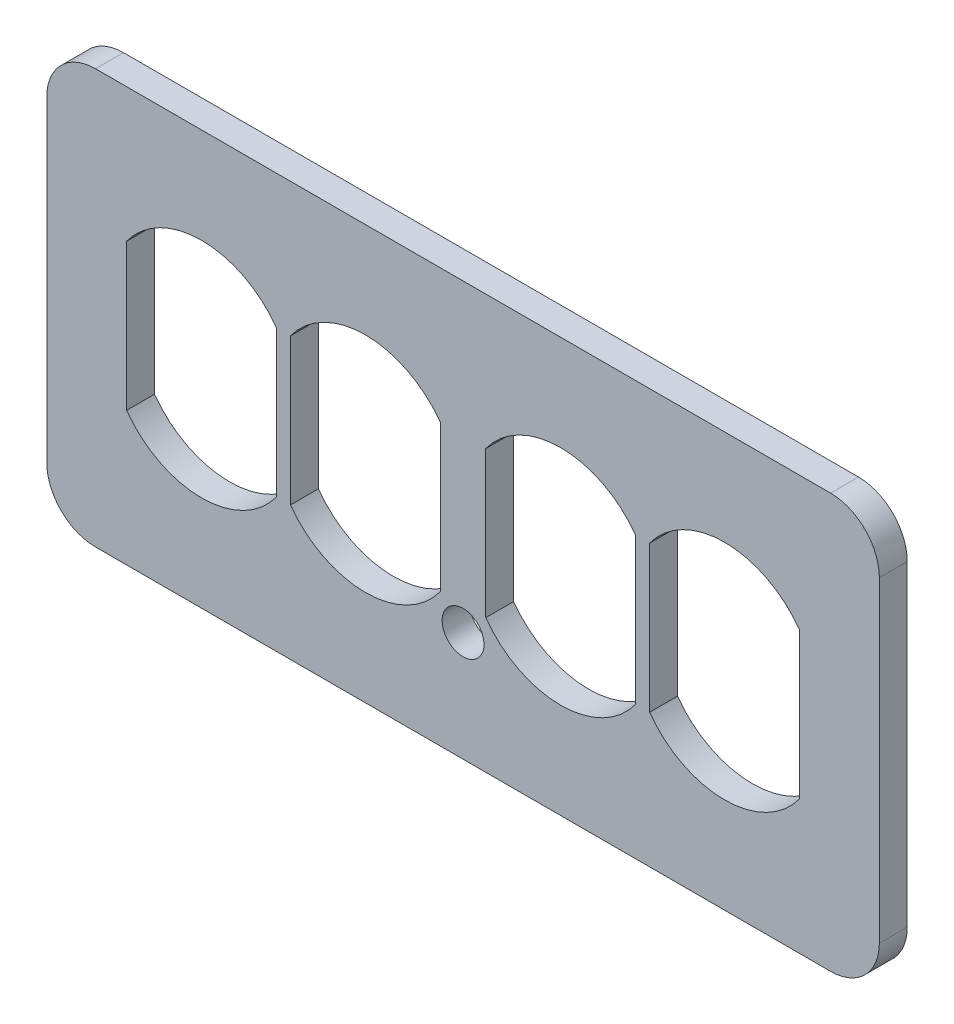
from build123d import *

# Parameters (mm, degrees)
SKETCH_1_W      = 119.4
SKETCH_1_H      = 59.4
SKETCH_1_R      = 3
EXTRUDE_1_DEPTH = 4
FILLET_1_R      = 7


with BuildPart() as part:
    # Эскиз1 → Бобышка-Вытянуть1 (new body)
    with BuildSketch(Plane.XY):
        Rectangle(SKETCH_1_W, SKETCH_1_H)
        with Locations((0, -13.97221548)):
            Circle(SKETCH_1_R, mode=Mode.SUBTRACT)
        with BuildLine():
            Line((3.25, 10.5), (3.25, -10.5))
            ThreePointArc((3.25, -10.5), (14, -16), (24.75, -10.5))
            Line((24.75, -10.5), (24.75, 10.5))
            ThreePointArc((24.75, 10.5), (14, 16), (3.25, 10.5))
        make_face(mode=Mode.SUBTRACT)
        with BuildLine():
            Line((48.25, 10.5), (48.25, -10.5))
            ThreePointArc((48.25, -10.5), (37.5, -16), (26.75, -10.5))
            Line((26.75, -10.5), (26.75, 10.5))
            ThreePointArc((26.75, 10.5), (37.5, 16), (48.25, 10.5))
        make_face(mode=Mode.SUBTRACT)
        with BuildLine():
            Line((-26.75, 10.5), (-26.75, -10.5))
            ThreePointArc((-26.75, -10.5), (-37.5, -16), (-48.25, -10.5))
            Line((-48.25, -10.5), (-48.25, 10.5))
            ThreePointArc((-48.25, 10.5), (-37.5, 16), (-26.75, 10.5))
        make_face(mode=Mode.SUBTRACT)
        with BuildLine():
            Line((-3.25, 10.5), (-3.25, -10.5))
            ThreePointArc((-3.25, -10.5), (-14, -16), (-24.75, -10.5))
            Line((-24.75, -10.5), (-24.75, 10.5))
            ThreePointArc((-24.75, 10.5), (-14, 16), (-3.25, 10.5))
        make_face(mode=Mode.SUBTRACT)
    extrude(amount=EXTRUDE_1_DEPTH)

    # Скругление1
    fillet_1_edges = [part.edges().sort_by_distance(p)[0] for p in [
        (59.7, -29.7, 2),
        (-59.7, -29.7, 2),
        (-59.7, 29.7, 2),
        (59.7, 29.7, 2),
    ]]
    fillet(fillet_1_edges, radius=FILLET_1_R)


solid = part.part
